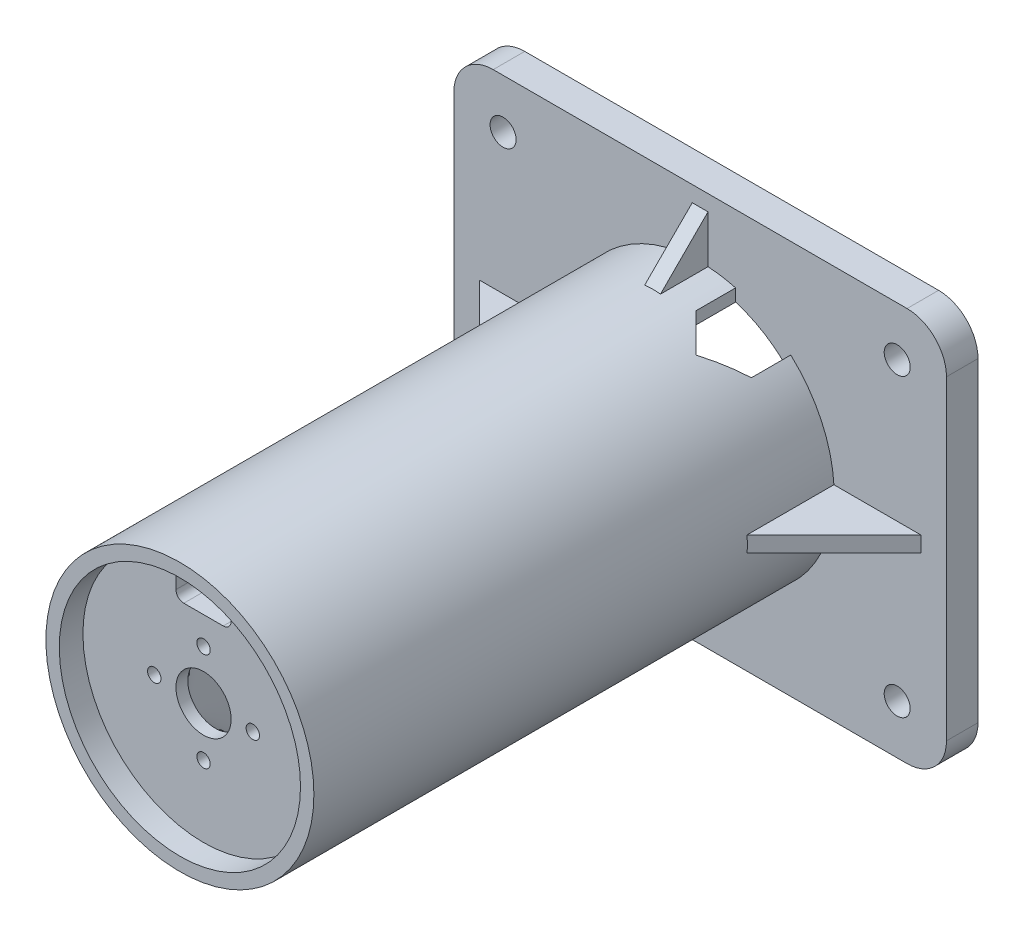
from build123d import *

# Parameters (mm, degrees)
SKETCH_1_R                                     = 31
FOOT_125X100_R10_T8_OPEN_D62_DEPTH             = 8
SKETCH_2_R                                     = 3.3
M6_GRID25_100X75_DEPTH                         = 8
SKETCH_3_R                                     = 34
SKETCH_3_R_2                                   = 31
HOLLOW_COLUMN_OD68_ID62_TOZ134_DEPTH           = 126
SKETCH_5_R                                     = 34
SKETCH_5_R_2                                   = 30.6
BOTTOM_CAP_WRAP_OD68_ID61P2_H6_DEPTH           = 6
STRAIGHT_TRIANGULAR_RIB_T4_NO_FILLETS_X_DEPTH  = 4
STRAIGHT_TRIANGULAR_RIB_T4_NO_FILLETS_Y_DEPTH  = 4
SKETCH_8_R                                     = 1.7
STATOR_4XM3_PCD25_THROUGH_WEB_DEPTH            = 6
SKETCH_9_R                                     = 3.3
UNDERSIDE_BOLT_AND_DRIVER_WELLS_D6P6_DEPTH     = 24
INNER_WALL_WIRE_GROOVE_W14_R2_DEPTH40_NO_DEPTH = 40
BOTTOM_REAR_OFFSET_WIRE_EXIT_14X10_45DEG_DEPTH = 25


with BuildPart() as part:
    # 草图1 → Foot_125x100_R10_T8_open_D62 (new body)
    with BuildSketch(Plane.XY):
        with BuildLine():
            Line((-52.5, -50), (52.5, -50))
            ThreePointArc((52.5, -50), (59.571067812, -47.071067812), (62.5, -40))
            Line((62.5, -40), (62.5, 40))
            ThreePointArc((62.5, 40), (59.571067812, 47.071067812), (52.5, 50))
            Line((52.5, 50), (-52.5, 50))
            ThreePointArc((-52.5, 50), (-59.571067812, 47.071067812), (-62.5, 40))
            Line((-62.5, 40), (-62.5, -40))
            ThreePointArc((-62.5, -40), (-59.571067812, -47.071067812), (-52.5, -50))
        make_face()
        Circle(SKETCH_1_R, mode=Mode.SUBTRACT)
    extrude(amount=FOOT_125X100_R10_T8_OPEN_D62_DEPTH)

    # 草图2 → M6_grid25_100x75 (cut)
    with BuildSketch(Plane.XY.offset(8)):
        with Locations((-50, -37.5)):
            Circle(SKETCH_2_R)
        with Locations((-50, 37.5)):
            Circle(SKETCH_2_R)
        with Locations((50, -37.5)):
            Circle(SKETCH_2_R)
        with Locations((50, 37.5)):
            Circle(SKETCH_2_R)
    extrude(amount=-M6_GRID25_100X75_DEPTH, mode=Mode.SUBTRACT)

    # 草图3 → Hollow_column_OD68_ID62_toZ134 (add)
    with BuildSketch(Plane.XY.offset(8)):
        Circle(SKETCH_3_R)
        Circle(SKETCH_3_R_2, mode=Mode.SUBTRACT)
    extrude(amount=HOLLOW_COLUMN_OD68_ID62_TOZ134_DEPTH)

    # 草图4 → Integral_motor_seat_45deg_internal_closure (revolve)
    with BuildSketch(Plane(origin=(0, 0, 0), x_dir=(1, 0, 0), z_dir=(0, 1, 0)), mode=Mode.PRIVATE) as integral_motor_seat_45deg_internal_closu_sk:
        Polygon((7, -131), (31, -107), (34, -107), (34, -134), (7, -134), align=None)
    revolve(integral_motor_seat_45deg_internal_closu_sk.sketch.rotate(Axis((0, 0, 0), (0, 0, 1)), 180), axis=Axis((0, 0, 0), (0, 0, 1)))

    # 草图5 → Bottom_cap_wrap_OD68_ID61p2_H6 (add)
    with BuildSketch(Plane.XY.offset(134)):
        Circle(SKETCH_5_R)
        Circle(SKETCH_5_R_2, mode=Mode.SUBTRACT)
    extrude(amount=BOTTOM_CAP_WRAP_OD68_ID61P2_H6_DEPTH)

    # 草图6 → Straight_triangular_rib_T4_no_fillets_x (add)
    with BuildSketch(Plane(origin=(-2, 0, 0), x_dir=(0, 0, -1), z_dir=(1, 0, 0))):
        Polygon((-8, -32), (-8, -46), (-22, -32), align=None)
        Polygon((-8, 32), (-8, 46), (-22, 32), align=None)
    extrude(amount=STRAIGHT_TRIANGULAR_RIB_T4_NO_FILLETS_X_DEPTH)

    # 草图7 → Straight_triangular_rib_T4_no_fillets_y (add)
    with BuildSketch(Plane(origin=(0, -2, 0), x_dir=(1, 0, 0), z_dir=(0, 1, 0))):
        Polygon((-32, -8), (-56, -8), (-32, -32), align=None)
        Polygon((32, -8), (56, -8), (32, -32), align=None)
    extrude(amount=STRAIGHT_TRIANGULAR_RIB_T4_NO_FILLETS_Y_DEPTH)

    # 草图8 → Stator_4xM3_PCD25_through_web (cut)
    with BuildSketch(Plane.XY.offset(134)):
        with Locations((12.5, 0)):
            Circle(SKETCH_8_R)
        with Locations((0, 12.5)):
            Circle(SKETCH_8_R)
        with Locations((-12.5, 0)):
            Circle(SKETCH_8_R)
        with Locations((0, -12.5)):
            Circle(SKETCH_8_R)
    extrude(amount=-STATOR_4XM3_PCD25_THROUGH_WEB_DEPTH, mode=Mode.SUBTRACT)

    # 草图9 → Underside_bolt_and_driver_wells_D6p6 (cut)
    with BuildSketch(Plane.XY.offset(128)):
        with Locations((12.5, 0)):
            Circle(SKETCH_9_R)
        with Locations((0, 12.5)):
            Circle(SKETCH_9_R)
        with Locations((-12.5, 0)):
            Circle(SKETCH_9_R)
        with Locations((0, -12.5)):
            Circle(SKETCH_9_R)
    extrude(amount=-UNDERSIDE_BOLT_AND_DRIVER_WELLS_D6P6_DEPTH, mode=Mode.SUBTRACT)

    # 草图10 → Inner_wall_wire_groove_W14_R2_depth40_no_external_bulge (cut)
    with BuildSketch(Plane.XY.offset(134)):
        with BuildLine():
            Line((-5, 19.5), (5, 19.5))
            ThreePointArc((5, 19.5), (6.414213562, 20.085786438), (7, 21.5))
            Line((7, 21.5), (7, 29.5))
            ThreePointArc((7, 29.5), (6.414213562, 30.914213562), (5, 31.5))
            Line((5, 31.5), (-5, 31.5))
            ThreePointArc((-5, 31.5), (-6.414213562, 30.914213562), (-7, 29.5))
            Line((-7, 29.5), (-7, 21.5))
            ThreePointArc((-7, 21.5), (-6.414213562, 20.085786438), (-5, 19.5))
        make_face()
    extrude(amount=-INNER_WALL_WIRE_GROOVE_W14_R2_DEPTH40_NO_DEPTH, mode=Mode.SUBTRACT)

    # 草图11 → Bottom_rear_offset_wire_exit_14x10_45deg_roof (cut)
    with BuildSketch(Plane(origin=(0, 40, 0), x_dir=(1, 0, 0), z_dir=(0, 1, 0))):
        Polygon((9, -8), (23, -8), (23, -18), (16, -25), (9, -18), align=None)
    extrude(amount=-BOTTOM_REAR_OFFSET_WIRE_EXIT_14X10_45DEG_DEPTH, mode=Mode.SUBTRACT)


solid = part.part
